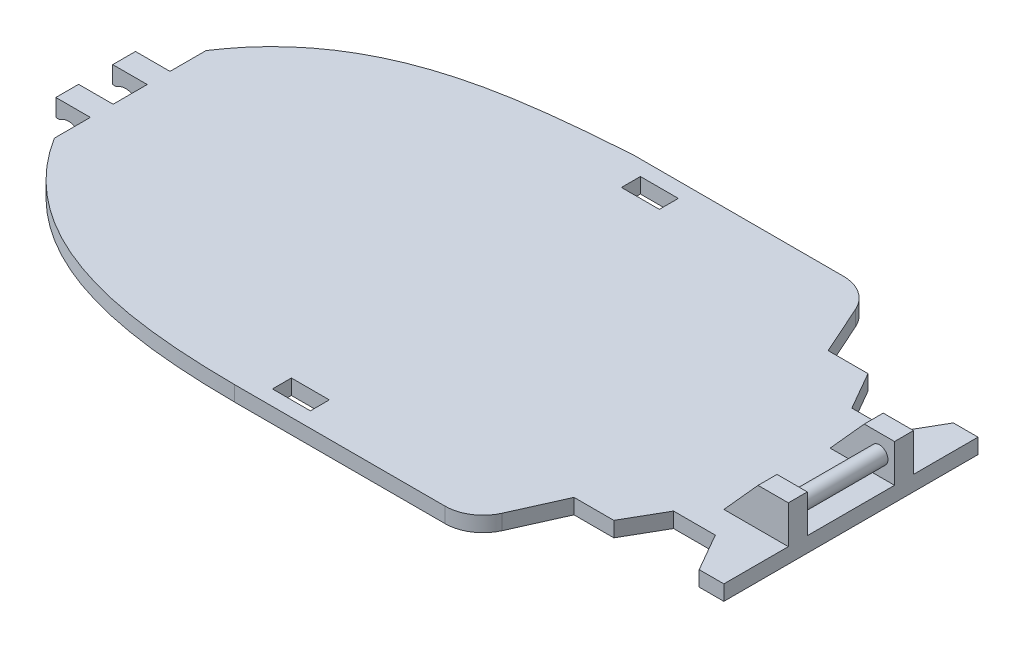
from build123d import *

# Parameters (mm, degrees)
BOSS_EXTRUDE1_DEPTH     = 4
BOSS_EXTRUDE2_START     = -45
BOSS_EXTRUDE2_DEPTH     = 3
BOSS_EXTRUDE3_START     = -39
BOSS_EXTRUDE3_DEPTH     = 3
BOSS_EXTRUDE4_REACH     = 213.107
SKETCH6_R               = 2.5
SKETCH7_W               = 10
SKETCH7_H               = 5
CUT_EXTRUDE1_DEPTH      = 10
CUT_EXTRUDE2_DEPTH      = 228.268563733
FILLET1_R               = 10
CUT_EXTRUDE3_DEPTH      = 228.268563733
SKETCH12_W              = 23
SKETCH12_H              = 10
CUT_EXTRUDE6_DEPTH      = 21
BOSS_EXTRUDE5_REACH     = 213.407
SKETCH13_R              = 2.25
CUT_EXTRUDE7_DEPTH      = 209.214432859
CUT_EXTRUDE7_DEPTH_BACK = 209.214432859
SKETCH15_W              = 6
SKETCH15_H              = 4.56544039
SKETCH15_H_2            = 4.038157292
BOSS_EXTRUDE6_DEPTH     = 1


with BuildPart() as part:
    # Sketch1 → Boss-Extrude1 (new body)
    with BuildSketch(Plane(origin=(0, 0, 0), x_dir=(1, 0, 0), z_dir=(0, 1, 0))):
        with BuildLine():
            Line((-110, 0), (0, 0))
            Line((0, 0), (0, -105))
            Line((0, -105), (-110, -105))
            add(Edge.make_bspline(
                [(-190, -72.5), (-172.262756658, -100.700379519), (-139.265999107, -104.836107107), (-110, -105)],
                knots=[0, 0, 0, 0, 1, 1, 1, 1], degree=3))
            Line((-190, -72.5), (-190, -32.5))
            add(Edge.make_bspline(
                [(-190, -32.5), (-171.707374586, -4.618888995), (-138.989901699, -2.178666842), (-110, 0)],
                knots=[0, 0, 0, 0, 1, 1, 1, 1], degree=3))
        make_face()
    extrude(amount=BOSS_EXTRUDE1_DEPTH)

    # Sketch2 → Boss-Extrude2 (add, symmetric)
    with BuildSketch(Plane.XY.offset(105).offset(BOSS_EXTRUDE2_START)):
        Polygon((-190, 4), (-201, 4), (-201, -11), (-191, -11), (-178, 0), align=None)
    boss_extrude2 = extrude(amount=BOSS_EXTRUDE2_DEPTH, both=True)

    # Mirror1: Boss-Extrude2 across plane
    add(boss_extrude2.mirror(Plane.XY.offset(52.5)))

    # Sketch5 → Boss-Extrude3 (add, symmetric)
    with BuildSketch(Plane.XY.offset(105).offset(BOSS_EXTRUDE3_START)):
        Polygon((-16.979807258, 4), (-7.979807258, 14), (0, 14), (0, 4), align=None)
    boss_extrude3 = extrude(amount=BOSS_EXTRUDE3_DEPTH, both=True)

    # Mirror4: Boss-Extrude3 across plane
    add(boss_extrude3.mirror(Plane.XY.offset(52.5)))

    # Sketch6 → Boss-Extrude4 (add, up to next)
    with BuildSketch(Plane.XY.offset(42), mode=Mode.PRIVATE) as boss_extrude4_sk1:
        with Locations(Location((-4, 10, 0), (0, 0, 180))):
            Circle(SKETCH6_R)
    boss_extrude4_tool1 = extrude(boss_extrude4_sk1.sketch, amount=BOSS_EXTRUDE4_REACH, mode=Mode.PRIVATE) - part.part
    add(boss_extrude4_tool1.solids().sort_by_distance((-4, 10, 42))[0])

    # Sketch7 → Cut-Extrude1 (cut)
    with BuildSketch(Plane(origin=(0, 4, 0), x_dir=(1, 0, 0), z_dir=(0, 1, 0))):
        with Locations((-99, -98.5)):
            Rectangle(SKETCH7_W, SKETCH7_H)
    cut_extrude1 = extrude(amount=-CUT_EXTRUDE1_DEPTH, mode=Mode.SUBTRACT)

    # Mirror5: Cut-Extrude1 across plane
    add(cut_extrude1.mirror(Plane.XY.offset(52.5)), mode=Mode.SUBTRACT)

    # Sketch10 → Cut-Extrude2 (cut, symmetric)
    with BuildSketch(Plane(origin=(0, 4, 0), x_dir=(1, 0, 0), z_dir=(0, 1, 0))):
        Polygon((0, -19), (-39.5, -19), (-48, 0), (0, 0), align=None)
    cut_extrude2 = extrude(amount=CUT_EXTRUDE2_DEPTH, both=True, mode=Mode.SUBTRACT)

    # Mirror6: Cut-Extrude2 across plane
    add(cut_extrude2.mirror(Plane.XY.offset(52.5)), mode=Mode.SUBTRACT)

    # Fillet1
    fillet1_edges = [part.edges().sort_by_distance(p)[0] for p in [
        (-48, 2, 0),
        (-48, 2, 105),
    ]]
    fillet(fillet1_edges, radius=FILLET1_R)

    # Sketch11 → Cut-Extrude3 (cut, symmetric)
    with BuildSketch(Plane(origin=(0, 4, 0), x_dir=(1, 0, 0), z_dir=(0, 1, 0))):
        Polygon((-6.5, -19), (-12.25, -29), (-23.25, -29), (-29, -19), align=None)
    cut_extrude3 = extrude(amount=CUT_EXTRUDE3_DEPTH, both=True, mode=Mode.SUBTRACT)

    # Mirror7: Cut-Extrude3 across plane
    add(cut_extrude3.mirror(Plane.XY.offset(52.5)), mode=Mode.SUBTRACT)

    # Sketch12 → Cut-Extrude6 (cut)
    with BuildSketch(Plane(origin=(0, 0, 0), x_dir=(0, 0, -1), z_dir=(1, 0, 0))):
        with Locations((-52.5, 9)):
            Rectangle(SKETCH12_W, SKETCH12_H)
    extrude(amount=-CUT_EXTRUDE6_DEPTH, mode=Mode.SUBTRACT)

    # Sketch13 → Boss-Extrude5 (add, up to next)
    with BuildSketch(Plane(origin=(0, 0, 64), x_dir=(-1, 0, 0), z_dir=(0, 0, -1)), mode=Mode.PRIVATE) as boss_extrude5_sk1:
        with Locations(Location((3.989903629, 9, 0), (0, 0, 180))):
            Circle(SKETCH13_R)
    boss_extrude5_tool1 = extrude(boss_extrude5_sk1.sketch, amount=BOSS_EXTRUDE5_REACH, mode=Mode.PRIVATE) - part.part
    add(boss_extrude5_tool1.solids().sort_by_distance((-3.989904, 9, 64))[0])

    # Sketch14 → Cut-Extrude7 (cut, two sides: drawn at the far end of the back side and taken through both)
    with BuildSketch(Plane.XY.offset(52.5).offset(-CUT_EXTRUDE7_DEPTH_BACK)):
        with BuildLine():
            Line((-198.09573372, 4), (-198.09573372, -0.56544039))
            ThreePointArc((-198.09573372, -0.56544039), (-191.693337136, -3.763641549), (-198.09573372, -6.961842708))
            Line((-198.09573372, -6.961842708), (-198.09573372, -11))
            Line((-198.09573372, -11), (-202.719197906, -12.115187625))
            Line((-202.719197906, -12.115187625), (-202.588499271, 4.842960165))
            Line((-202.588499271, 4.842960165), (-198.09573372, 4))
        make_face()
    extrude(amount=CUT_EXTRUDE7_DEPTH + CUT_EXTRUDE7_DEPTH_BACK, mode=Mode.SUBTRACT)

    # Sketch15 → Boss-Extrude6 (add)
    with BuildSketch(Plane.ZY.offset(198.09573372)):
        with Locations((60, 1.717279805)):
            Rectangle(SKETCH15_W, SKETCH15_H)
        with Locations((45, 1.717279805)):
            Rectangle(SKETCH15_W, SKETCH15_H)
        with Locations((45, -8.980921354)):
            Rectangle(SKETCH15_W, SKETCH15_H_2)
        with Locations((60, -8.980921354)):
            Rectangle(SKETCH15_W, SKETCH15_H_2)
    extrude(amount=BOSS_EXTRUDE6_DEPTH)


solid = part.part
